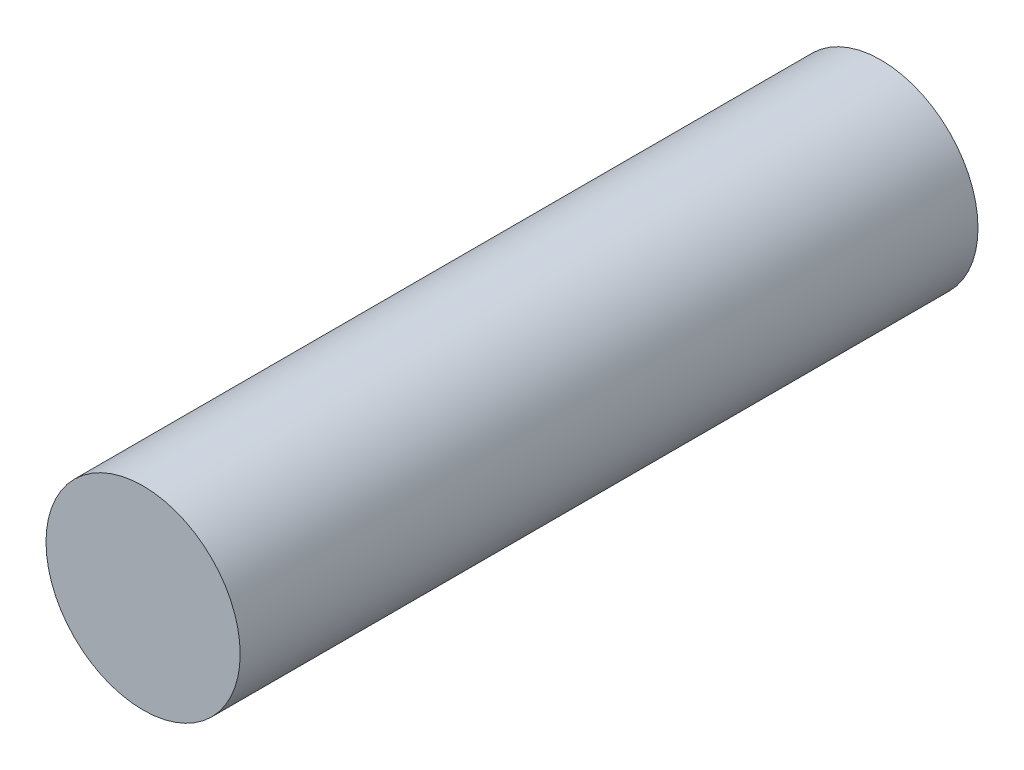
from build123d import *

# Parameters (mm, degrees)
SKETCH1_R           = 1.5875
BOSS_EXTRUDE1_DEPTH = 12.065


with BuildPart() as part:
    # Sketch1 → Boss-Extrude1 (new body)
    with BuildSketch(Plane.XY):
        with Locations(Location((0, 0, 0), (0, 0, 180))):
            Circle(SKETCH1_R)
    extrude(amount=BOSS_EXTRUDE1_DEPTH)


solid = part.part
